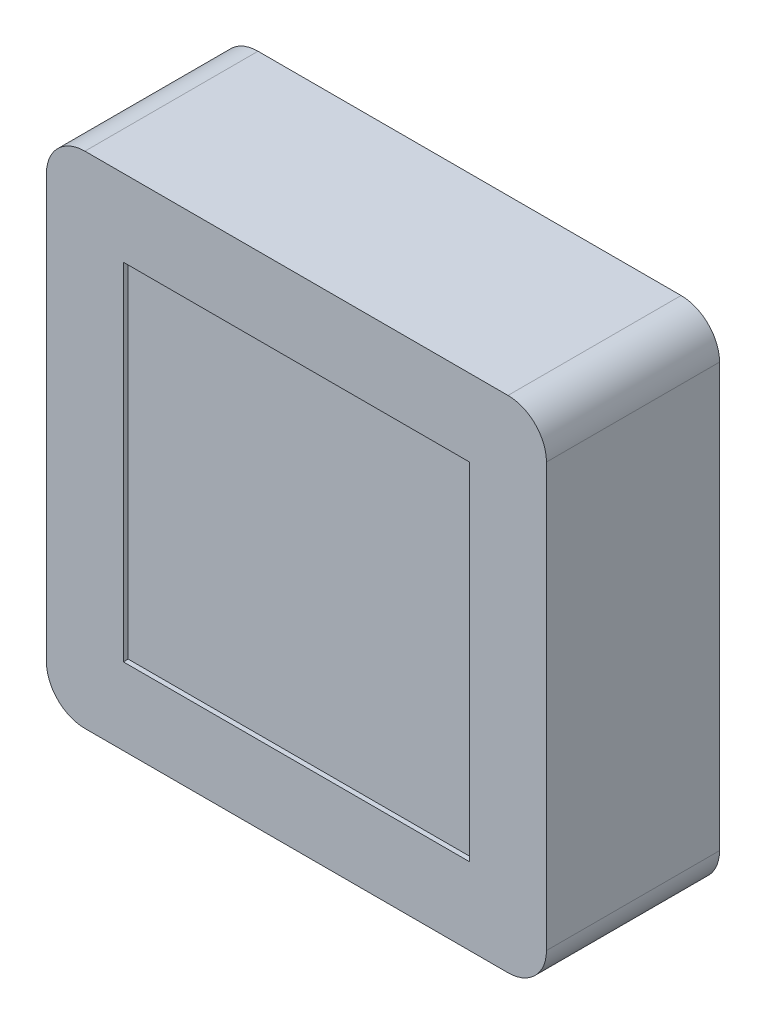
from build123d import *

# Parameters (mm, degrees)
SKETCH1_W           = 26
SKETCH1_H           = 26
BOSS_EXTRUDE1_DEPTH = 4.5
FILLET1_R           = 2
SKETCH2_W           = 18
SKETCH2_H           = 18
CUT_EXTRUDE1_DEPTH  = 0.25
SKETCH3_R           = 0.95
BOSS_EXTRUDE2_DEPTH = 1.5


with BuildPart() as part:
    # Sketch1 → Boss-Extrude1 (new, symmetric)
    with BuildSketch(Plane.XY):
        Rectangle(SKETCH1_W, SKETCH1_H)
    extrude(amount=BOSS_EXTRUDE1_DEPTH, both=True)

    # Fillet1
    fillet1_edges = [part.edges().sort_by_distance(p)[0] for p in [
        (-13, 13, 0),
        (13, 13, 0),
        (13, -13, 0),
        (-13, -13, 0),
    ]]
    fillet(fillet1_edges, radius=FILLET1_R)

    # Sketch2 → Cut-Extrude1 (cut, symmetric)
    with BuildSketch(Plane.XY.offset(4.5)):
        Rectangle(SKETCH2_W, SKETCH2_H)
    extrude(amount=CUT_EXTRUDE1_DEPTH, both=True, mode=Mode.SUBTRACT)

    # Sketch3 → Boss-Extrude2 (add, symmetric)
    with BuildSketch(Plane(origin=(0, 0, -4.5), x_dir=(-1, 0, 0), z_dir=(0, 0, -1))):
        with Locations(Location((-9, 0, 0), (0, 0, 180))):
            Circle(SKETCH3_R)
        with Locations(Location((9, 0, 0), (0, 0, 180))):
            Circle(SKETCH3_R)
    extrude(amount=BOSS_EXTRUDE2_DEPTH, both=True)


solid = part.part
